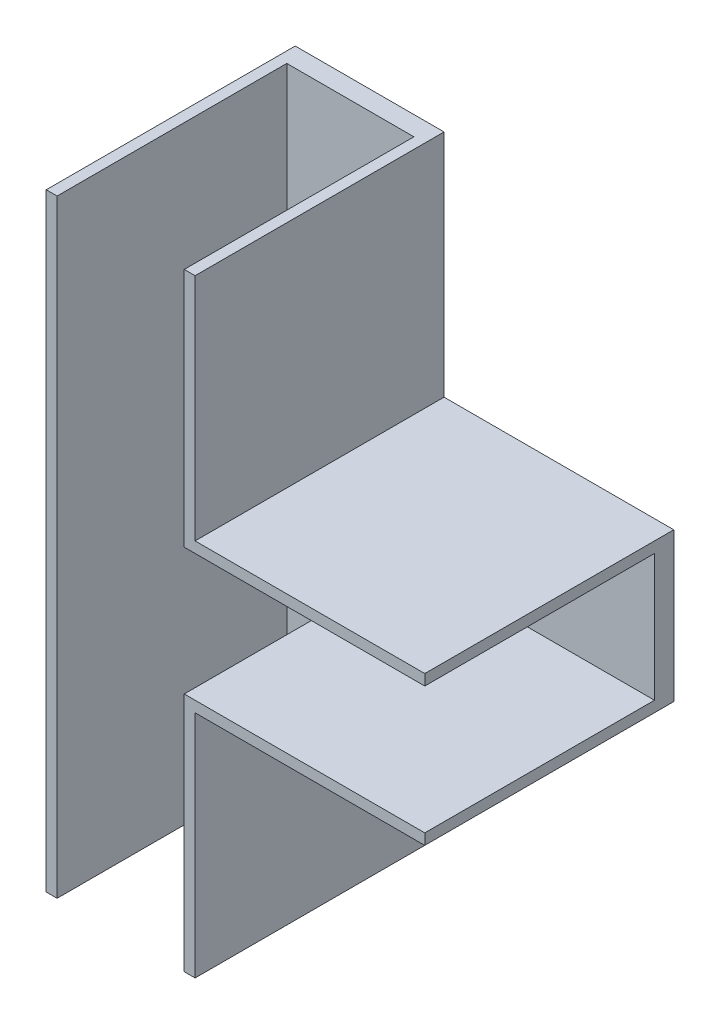
from build123d import *

# Parameters (mm, degrees)
BOSS_EXTRUDE1_DEPTH = 0.8
SKETCH2_W           = 0.45
SKETCH2_H           = 25.2222
BOSS_EXTRUDE2_DEPTH = 9.525


with BuildPart() as part:
    # Sketch1 → Boss-Extrude1 (new body)
    with BuildSketch(Plane.XY):
        Polygon((0, 0), (0, 25.2222), (6.1722, 25.2222), (6.1722, 15.6972), (15.6972, 15.6972), (15.6972, 9.525), (6.1722, 9.525), (6.1722, 0), align=None)
    extrude(amount=BOSS_EXTRUDE1_DEPTH)

    # Sketch2 → Boss-Extrude2 (add)
    with BuildSketch(Plane.XY.offset(0.8)):
        Polygon((6.1722, 0), (6.1722, 9.525), (15.6972, 9.525), (15.6972, 9.975), (5.7222, 9.975), (5.7222, 0), align=None)
        Polygon((15.6972, 15.6972), (6.1722, 15.6972), (6.1722, 25.2222), (5.7222, 25.2222), (5.7222, 15.2472), (15.6972, 15.2472), align=None)
        with Locations((0.225, 12.6111)):
            Rectangle(SKETCH2_W, SKETCH2_H)
    extrude(amount=BOSS_EXTRUDE2_DEPTH)


solid = part.part
